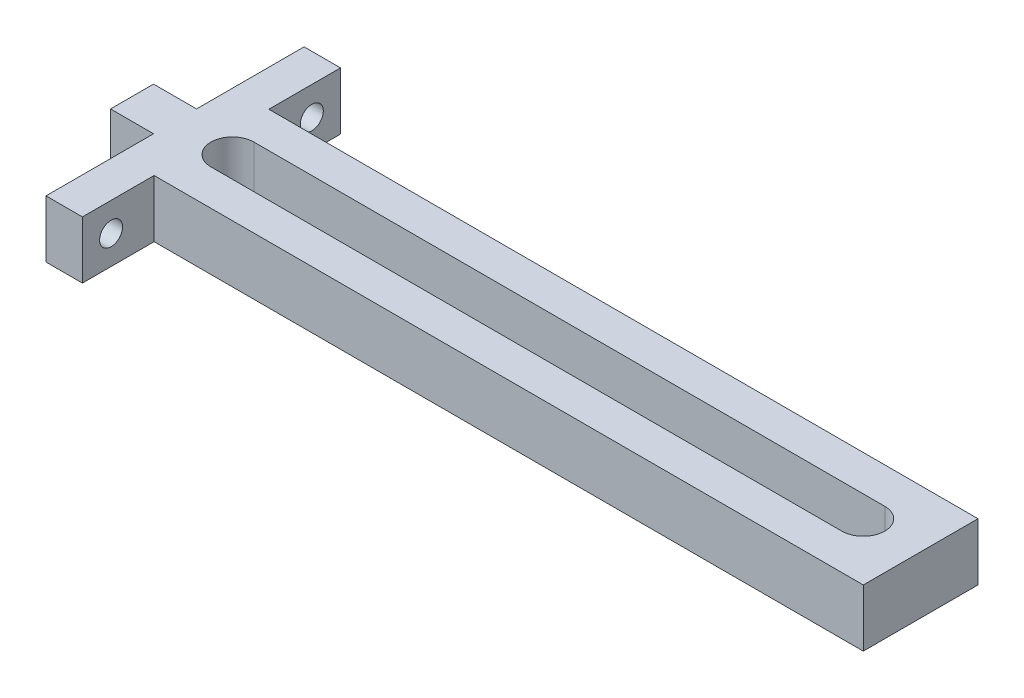
from build123d import *

# Parameters (mm, degrees)
CROQUIS1_W              = 12.7
CROQUIS1_H              = 25
CROQUIS1_H_2            = 5
CROQUIS1_W_2            = 15
CROQUIS1_H_3            = 15
SALIENTE_EXTRUIR1_DEPTH = 20
CROQUIS2_R              = 4
CORTAR_EXTRUIR1_DEPTH   = 12.7


with BuildPart() as part:
    # Croquis1 → Saliente-Extruir1 (new body)
    # profile 1 of 6: a face of its own
    with BuildSketch(Plane(origin=(0, 0, 0), x_dir=(1, 0, 0), z_dir=(0, 1, 0))):
        Polygon((-117.3, -20), (130, -20), (130, 20), (-117.3, 20), (-117.3, 15), (-130, 15), (-130, 7.5), (-130, -7.5), (-130, -15), (-117.3, -15), align=None)
        with BuildLine():
            ThreePointArc((110, 7.5), (117.5, 0), (110, -7.5))
            Line((110, -7.5), (-110, -7.5))
            ThreePointArc((-110, -7.5), (-117.5, 0), (-110, 7.5))
            Line((-110, 7.5), (110, 7.5))
        make_face(mode=Mode.SUBTRACT)
    # profile 2 of 6: a face of its own
    with BuildSketch(Plane(origin=(0, 0, 0), x_dir=(1, 0, 0), z_dir=(0, 1, 0))):
        with Locations((-123.65, -32.5)):
            Rectangle(CROQUIS1_W, CROQUIS1_H)
    # profile 3 of 6: a face of its own
    with BuildSketch(Plane(origin=(0, 0, 0), x_dir=(1, 0, 0), z_dir=(0, 1, 0))):
        with Locations((-123.65, -17.5)):
            Rectangle(CROQUIS1_W, CROQUIS1_H_2)
    # profile 4 of 6: a face of its own
    with BuildSketch(Plane(origin=(0, 0, 0), x_dir=(1, 0, 0), z_dir=(0, 1, 0))):
        with Locations((-123.65, 17.5)):
            Rectangle(CROQUIS1_W, CROQUIS1_H_2)
    # profile 5 of 6: a face of its own
    with BuildSketch(Plane(origin=(0, 0, 0), x_dir=(1, 0, 0), z_dir=(0, 1, 0))):
        with Locations((-123.65, 32.5)):
            Rectangle(CROQUIS1_W, CROQUIS1_H)
    # profile 6 of 6: a face of its own
    with BuildSketch(Plane(origin=(0, 0, 0), x_dir=(1, 0, 0), z_dir=(0, 1, 0))):
        with Locations((-137.5, 0)):
            Rectangle(CROQUIS1_W_2, CROQUIS1_H_3)
    extrude(amount=SALIENTE_EXTRUIR1_DEPTH)

    # Croquis2 → Cortar-Extruir1 (cut)
    with BuildSketch(Plane.ZY.offset(130)):
        with Locations((-35, 10)):
            Circle(CROQUIS2_R)
        with Locations((35, 10)):
            Circle(CROQUIS2_R)
    extrude(amount=-CORTAR_EXTRUIR1_DEPTH, mode=Mode.SUBTRACT)


solid = part.part
